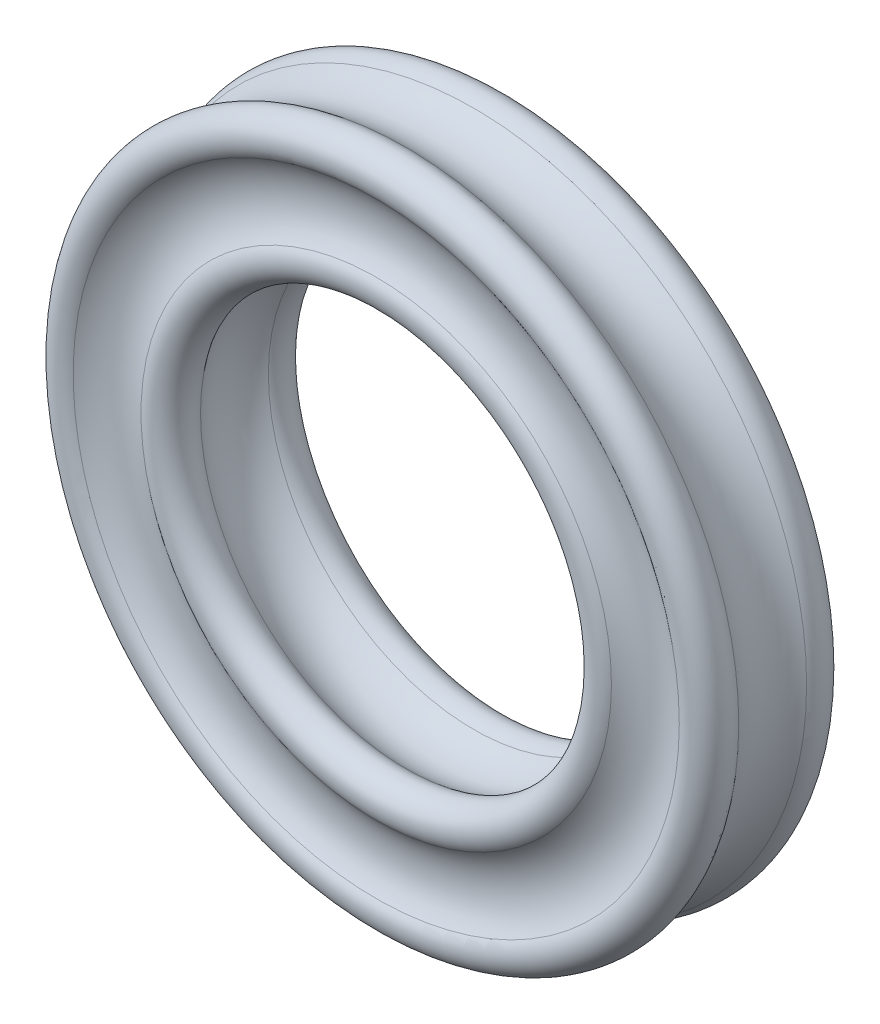
from build123d import *


with BuildPart() as part:
    # Sketch1 → Revolve1 (revolve)
    with BuildSketch(Plane(origin=(0, 0, 0), x_dir=(0, 0, -1), z_dir=(1, 0, 0)), mode=Mode.PRIVATE) as revolve1_sk:
        with BuildLine():
            ThreePointArc((-0.642857143, 6.306394437), (0, 6.072380529), (0.642857143, 6.306394437))
            ThreePointArc((0.642857143, 6.306394437), (1.182842712, 6.282842712), (1.206394437, 5.742857143))
            ThreePointArc((1.206394437, 5.742857143), (0.972380529, 5.1), (1.206394437, 4.457142857))
            ThreePointArc((1.206394437, 4.457142857), (1.182842712, 3.917157288), (0.642857143, 3.893605563))
            ThreePointArc((0.642857143, 3.893605563), (0, 4.127619471), (-0.642857143, 3.893605563))
            ThreePointArc((-0.642857143, 3.893605563), (-1.182842712, 3.917157288), (-1.206394437, 4.457142857))
            ThreePointArc((-1.206394437, 4.457142857), (-0.972380529, 5.1), (-1.206394437, 5.742857143))
            ThreePointArc((-1.206394437, 5.742857143), (-1.182842712, 6.282842712), (-0.642857143, 6.306394437))
        make_face()
    revolve(revolve1_sk.sketch.rotate(Axis((0, 0, 0), (0, 0, -1)), 90), axis=Axis((0, 0, 0), (0, 0, -1)))


solid = part.part
